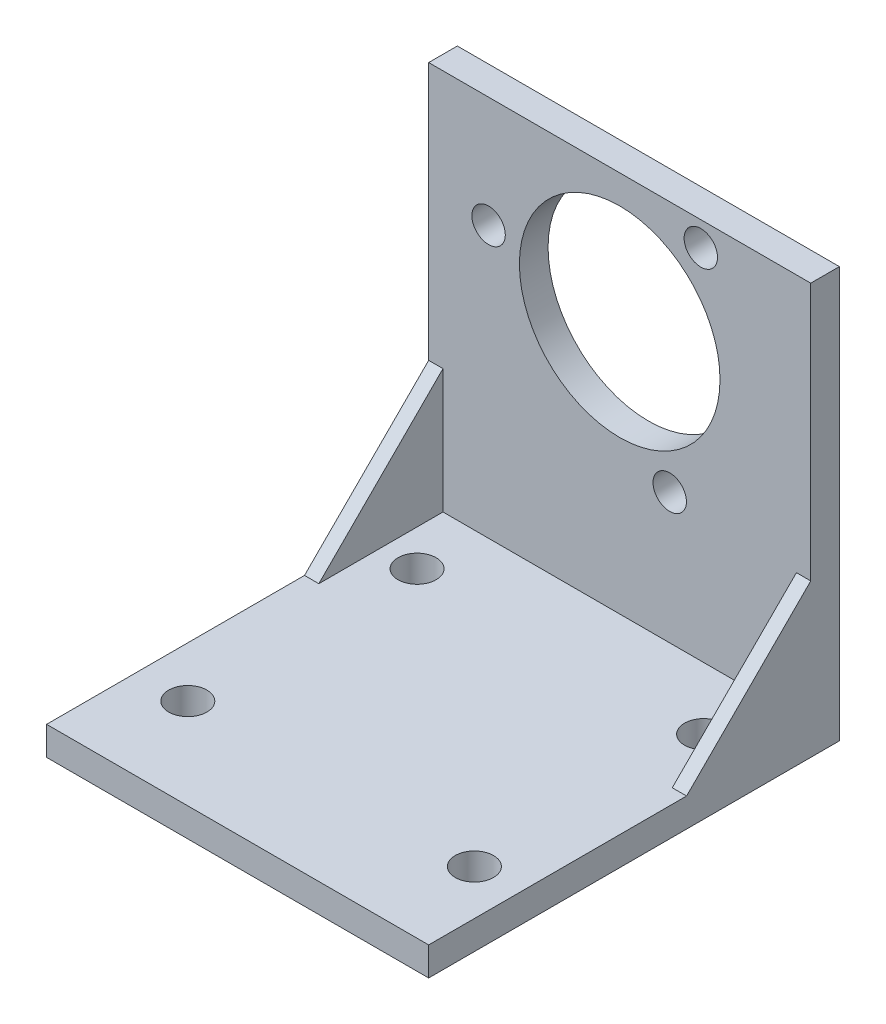
from build123d import *

# Parameters (mm, degrees)
SKETCH1_W           = 40
SKETCH1_H           = 43
SKETCH1_R           = 2
BOSS_EXTRUDE1_DEPTH = 3
SKETCH4_W           = 40
SKETCH4_H           = 3
BOSS_EXTRUDE2_DEPTH = 40
SKETCH5_R           = 1.75
SKETCH5_R_2         = 10.5
CUT_EXTRUDE1_DEPTH  = 24
BOSS_EXTRUDE3_DEPTH = 1.5
BOSS_EXTRUDE4_DEPTH = 1.5


with BuildPart() as part:
    # Sketch1 → Boss-Extrude1 (new body)
    with BuildSketch(Plane(origin=(0, 0, 0), x_dir=(1, 0, 0), z_dir=(0, 1, 0))):
        Rectangle(SKETCH1_W, SKETCH1_H)
        with Locations(Location((-14.715053003, 12, 0), (0, 0, 270))):
            Circle(SKETCH1_R, mode=Mode.SUBTRACT)
        with Locations(Location((15.284946997, 12, 0), (0, 0, 270))):
            Circle(SKETCH1_R, mode=Mode.SUBTRACT)
        with Locations(Location((-14.715053003, -12, 0), (0, 0, 270))):
            Circle(SKETCH1_R, mode=Mode.SUBTRACT)
        with Locations(Location((15.284946997, -12, 0), (0, 0, 270))):
            Circle(SKETCH1_R, mode=Mode.SUBTRACT)
    extrude(amount=-BOSS_EXTRUDE1_DEPTH)

    # Sketch4 → Boss-Extrude2 (add)
    with BuildSketch(Plane(origin=(0, 0, 0), x_dir=(1, 0, 0), z_dir=(0, 1, 0))):
        with Locations((0, 20)):
            Rectangle(SKETCH4_W, SKETCH4_H)
    extrude(amount=BOSS_EXTRUDE2_DEPTH)

    # Sketch5 → Cut-Extrude1 (cut)
    with BuildSketch(Plane.XY.offset(-18.5)):
        with Locations((8.491960292, 37.449274423)):
            Circle(SKETCH5_R)
        with Locations((-13.72832995, 28.379616129)):
            Circle(SKETCH5_R)
        with Locations((5.236369657, 13.671109447)):
            Circle(SKETCH5_R)
        with Locations((0, 26.5)):
            Circle(SKETCH5_R_2)
    extrude(amount=-CUT_EXTRUDE1_DEPTH, mode=Mode.SUBTRACT)

    # Sketch7 → Boss-Extrude3 (add)
    with BuildSketch(Plane(origin=(20, 0, 0), x_dir=(0, 0, -1), z_dir=(1, 0, 0))):
        Polygon((18.5, 0), (18.5, 13), (5.5, 0), align=None)
    extrude(amount=-BOSS_EXTRUDE3_DEPTH)

    # Sketch8 → Boss-Extrude4 (add)
    with BuildSketch(Plane.ZY.offset(20)):
        Polygon((-18.5, 0), (-18.5, 13), (-5.5, 0), align=None)
    extrude(amount=-BOSS_EXTRUDE4_DEPTH)


solid = part.part
